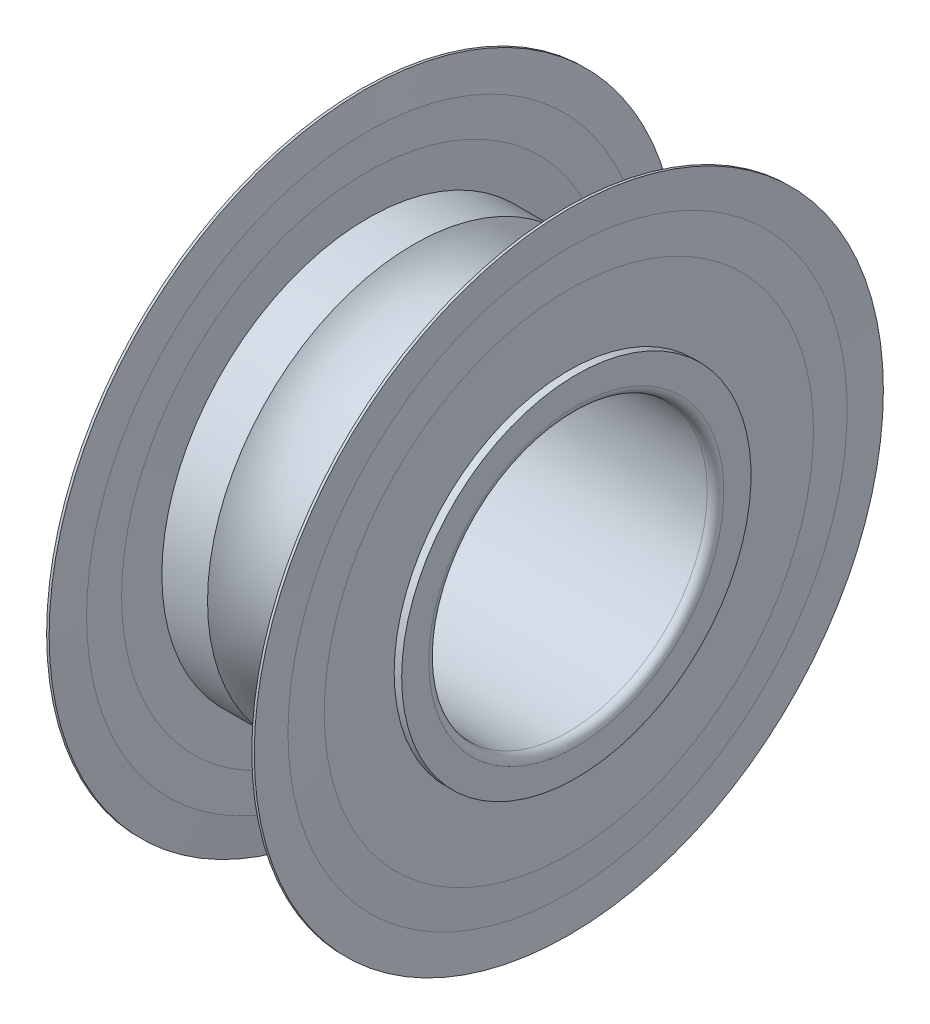
from build123d import *


with BuildPart() as part:
    # Sketch1 → Revolve1 (revolve)
    with BuildSketch(Plane.XY, mode=Mode.PRIVATE) as revolve1_sk:
        with BuildLine():
            Line((0, 7.3), (0, 5.3))
            ThreePointArc((0, 5.3), (0.087867966, 5.087867966), (0.3, 5))
            Line((0.3, 5), (7.7, 5))
            ThreePointArc((7.7, 5), (7.912132034, 5.087867966), (8, 5.3))
            Line((8, 5.3), (8, 7.3))
            ThreePointArc((8, 7.3), (7.970710678, 7.370710678), (7.9, 7.4))
            Line((7.9, 7.4), (5.849097347, 7.4))
            ThreePointArc((5.849097347, 7.4), (4, 6.519), (2.150902653, 7.4))
            Line((2.150902653, 7.4), (0.1, 7.4))
            ThreePointArc((0.1, 7.4), (0.029289322, 7.370710678), (0, 7.3))
        make_face()
    revolve(revolve1_sk.sketch.rotate(Axis((50, 0, 0), (-1, 0, 0)), 270), axis=Axis((50, 0, 0), (-1, 0, 0)))

    # Sketch2 → Cut-Revolve1 (revolve, cut)
    with BuildSketch(Plane.XY, mode=Mode.PRIVATE) as cut_revolve1_sk:
        with BuildLine():
            Line((0, 9.975), (0, 6.275))
            Line((0, 6.275), (0.285, 6.275))
            ThreePointArc((0.285, 6.275), (0.444099026, 6.340900974), (0.51, 6.5))
            Line((0.51, 6.5), (0.51, 9.525))
            Line((0.51, 9.525), (7.49, 9.525))
            Line((7.49, 9.525), (7.49, 6.5))
            ThreePointArc((7.49, 6.5), (7.555900974, 6.340900974), (7.715, 6.275))
            Line((7.715, 6.275), (8, 6.275))
            Line((8, 6.275), (8, 9.975))
            Line((8, 9.975), (0, 9.975))
        make_face()
    revolve(cut_revolve1_sk.sketch.rotate(Axis((50, 0, 0), (-1, 0, 0)), 270), axis=Axis((50, 0, 0), (-1, 0, 0)), mode=Mode.SUBTRACT)

    # Sketch3 → Revolve2 (revolve)
    with BuildSketch(Plane.XY, mode=Mode.PRIVATE) as revolve2_sk:
        Polygon((0.27, 11.3), (0.315, 10.04375), (0.27, 8.7875), (0.27, 6.275), (0.36, 6.275), (0.45, 8.7875), (0.45, 10.04375), (0.36, 11.3), align=None)
    revolve(revolve2_sk.sketch.rotate(Axis((50, 0, 0), (-1, 0, 0)), 270), axis=Axis((50, 0, 0), (-1, 0, 0)))

    # Sketch4 → Revolve3 (revolve)
    with BuildSketch(Plane.XY, mode=Mode.PRIVATE) as revolve3_sk:
        Polygon((7.55, 10.04375), (7.55, 8.7875), (7.64, 6.275), (7.73, 6.275), (7.73, 8.7875), (7.685, 10.04375), (7.73, 11.3), (7.64, 11.3), align=None)
    revolve(revolve3_sk.sketch.rotate(Axis((50, 0, 0), (-1, 0, 0)), 270), axis=Axis((50, 0, 0), (-1, 0, 0)))


solid = part.part
